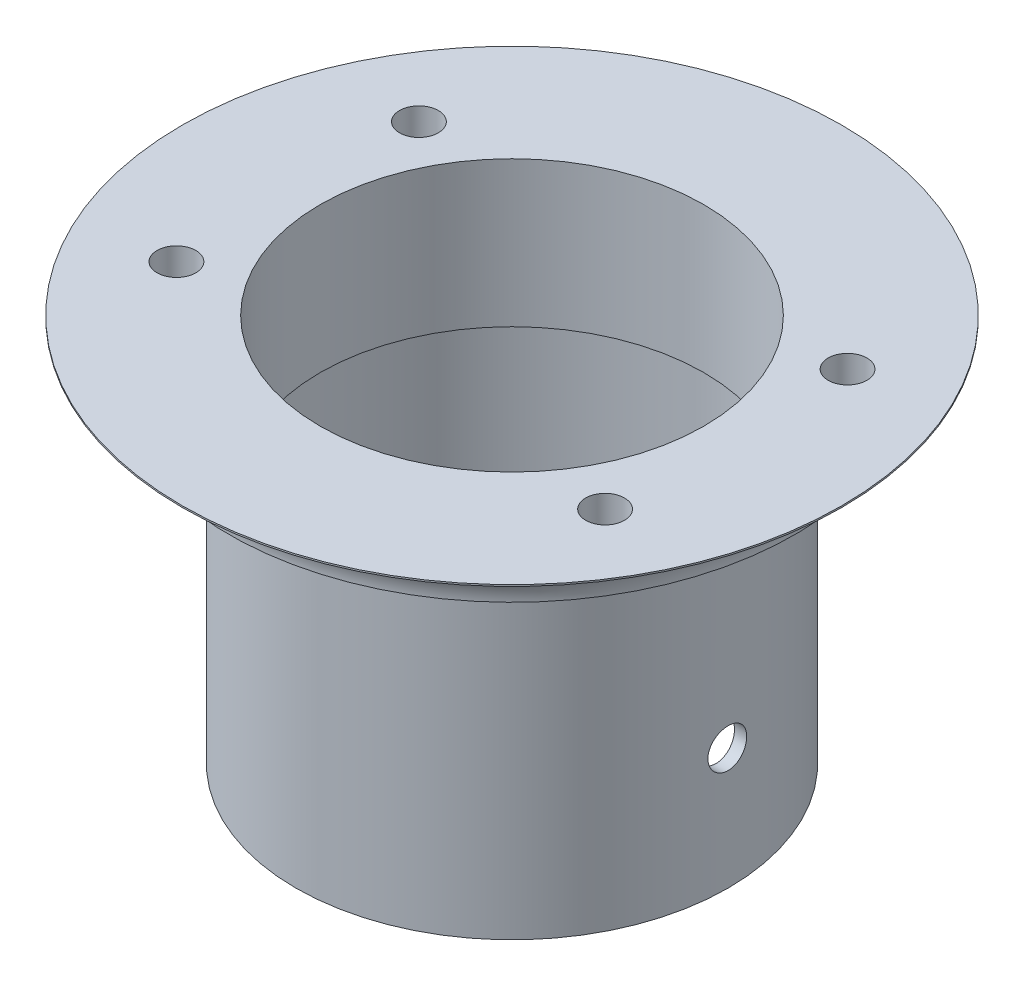
from build123d import *

# Parameters (mm, degrees)
SKETCH1_R               = 34
BOSS_EXTRUDE1_DEPTH     = 10
SKETCH2_R               = 19.7871926
SKETCH2_R_2             = 2
CUT_EXTRUDE1_DEPTH      = 10
SKETCH3_R               = 4.837531333
SKETCH4_W               = 4.837531333
SKETCH4_H               = 4.837531333
CUT_EXTRUDE3_DEPTH      = 38
CUT_EXTRUDE3_DEPTH_BACK = 38
SKETCH5_W               = 72.361656805
SKETCH5_H               = 8.896778435
BOSS_EXTRUDE2_START     = 35
SKETCH6_R               = 22.2871926
SKETCH6_R_2             = 19.7871926
BOSS_EXTRUDE2_DEPTH     = 35
SKETCH7_R               = 21.0371926
SKETCH7_R_2             = 19.7871926
CUT_EXTRUDE4_DEPTH      = 25
CUT_EXTRUDE5_DEPTH      = 59
CUT_EXTRUDE5_DEPTH_BACK = 45
SKETCH9_R               = 2


with BuildPart() as part:
    # Sketch1 → Boss-Extrude1 (new body)
    with BuildSketch(Plane(origin=(0, 0, 0), x_dir=(1, 0, 0), z_dir=(0, 1, 0))):
        Circle(SKETCH1_R)
    extrude(amount=BOSS_EXTRUDE1_DEPTH)

    # Sketch2 → Cut-Extrude1 (cut)
    with BuildSketch(Plane.XZ):
        Circle(SKETCH2_R)
        with Locations((-22.1, 12.5)):
            Circle(SKETCH2_R_2)
        with Locations((22.1, 12.5)):
            Circle(SKETCH2_R_2)
        with Locations((22.1, -12.5)):
            Circle(SKETCH2_R_2)
        with Locations((-22.1, -12.5)):
            Circle(SKETCH2_R_2)
    extrude(amount=-CUT_EXTRUDE1_DEPTH, mode=Mode.SUBTRACT)

    # Sketch3 → Cut-Revolve1 (revolve, cut)
    with BuildSketch(Plane(origin=(0, 0, 0), x_dir=(0, 0, -1), z_dir=(1, 0, 0))):
        with Locations((-34, 5)):
            Circle(SKETCH3_R)
    revolve(axis=Axis((0, 0, 0), (0, 1, 0)), mode=Mode.SUBTRACT)

    # Sketch4 → Cut-Revolve2 (revolve, cut)
    with BuildSketch(Plane(origin=(0, 0, 0), x_dir=(0, 0, -1), z_dir=(1, 0, 0))):
        with Locations((-31.581234333, 2.581234333)):
            Rectangle(SKETCH4_W, SKETCH4_H)
    revolve(axis=Axis((0, 0, 0), (0, 1, 0)), mode=Mode.SUBTRACT)

    # Sketch5 → Cut-Extrude3 (cut, two sides: drawn at the far end of the back side and taken through both)
    with BuildSketch(Plane(origin=(0, 0, 0), x_dir=(0, 0, -1), z_dir=(1, 0, 0)).offset(-CUT_EXTRUDE3_DEPTH_BACK)):
        with Locations((-0.901301775, 0.551610782)):
            Rectangle(SKETCH5_W, SKETCH5_H)
    extrude(amount=CUT_EXTRUDE3_DEPTH + CUT_EXTRUDE3_DEPTH_BACK, mode=Mode.SUBTRACT)

    # Sketch6 → Boss-Extrude2 (add)
    with BuildSketch(Plane.XZ.offset(-5).offset(BOSS_EXTRUDE2_START)):
        Circle(SKETCH6_R)
        Circle(SKETCH6_R_2, mode=Mode.SUBTRACT)
    extrude(amount=-BOSS_EXTRUDE2_DEPTH)

    # Sketch7 → Cut-Extrude4 (cut)
    with BuildSketch(Plane.XZ.offset(30)):
        Circle(SKETCH7_R)
        Circle(SKETCH7_R_2, mode=Mode.SUBTRACT)
    extrude(amount=-CUT_EXTRUDE4_DEPTH, mode=Mode.SUBTRACT)

    # Sketch9 → Cut-Extrude5 (cut, two sides: drawn at the far end of the back side and taken through both)
    with BuildSketch(Plane(origin=(0, 0, 0), x_dir=(0, 0, -1), z_dir=(1, 0, 0)).offset(-CUT_EXTRUDE5_DEPTH_BACK)):
        with Locations((0, -17.5)):
            Circle(SKETCH9_R)
    extrude(amount=CUT_EXTRUDE5_DEPTH + CUT_EXTRUDE5_DEPTH_BACK, mode=Mode.SUBTRACT)


solid = part.part
